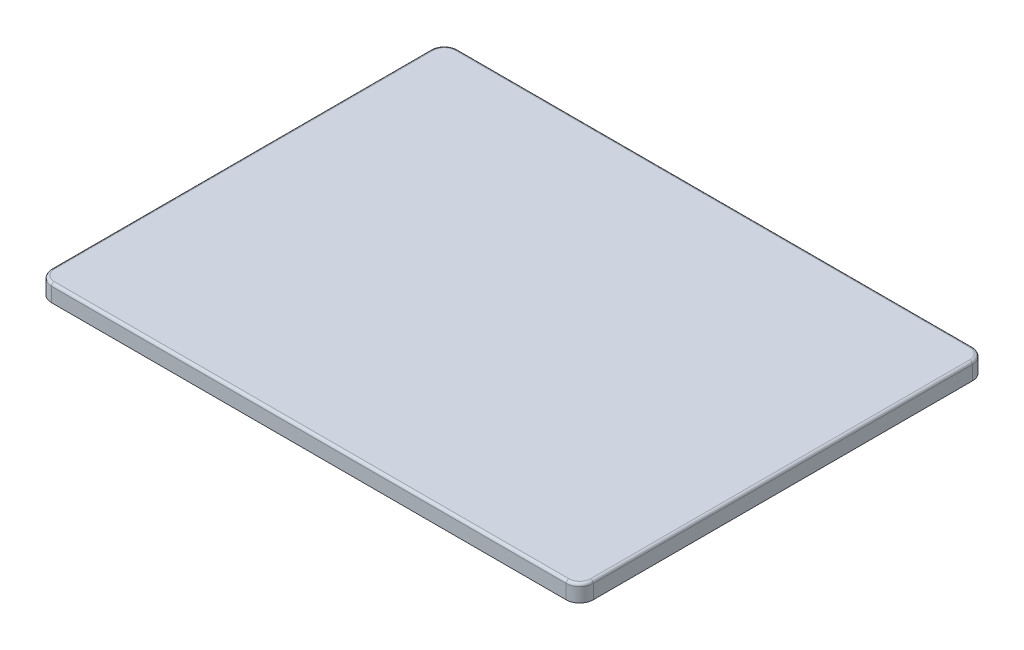
from build123d import *

# Parameters (mm, degrees)
SKETCH1_W           = 50.8
SKETCH1_H           = 38.1
BOSS_EXTRUDE1_DEPTH = 1.5875
FILLET1_R           = 1.27
FILLET2_R           = 0.254


with BuildPart() as part:
    # Sketch1 → Boss-Extrude1 (new body)
    with BuildSketch(Plane(origin=(0, 0, 0), x_dir=(1, 0, 0), z_dir=(0, 1, 0))):
        Rectangle(SKETCH1_W, SKETCH1_H)
    extrude(amount=BOSS_EXTRUDE1_DEPTH)

    # Fillet1
    fillet1_edges = [part.edges().sort_by_distance(p)[0] for p in [
        (25.4, 0.79375, 19.05),
        (-25.4, 0.79375, 19.05),
        (-25.4, 0.79375, -19.05),
        (25.4, 0.79375, -19.05),
    ]]
    fillet(fillet1_edges, radius=FILLET1_R)

    # Fillet2
    fillet2_edges = [part.edges().sort_by_distance(p)[0] for p in [
        (25.4, 1.5875, 0),
        (0, 1.5875, 19.05),
        (0, 1.5875, -19.05),
        (-25.4, 1.5875, 0),
        (-25.028025612, 1.5875, 18.678025612),
        (-25.028025612, 1.5875, -18.678025612),
        (25.028025612, 1.5875, -18.678025612),
        (25.028025612, 1.5875, 18.678025612),
    ]]
    fillet(fillet2_edges, radius=FILLET2_R)


solid = part.part
